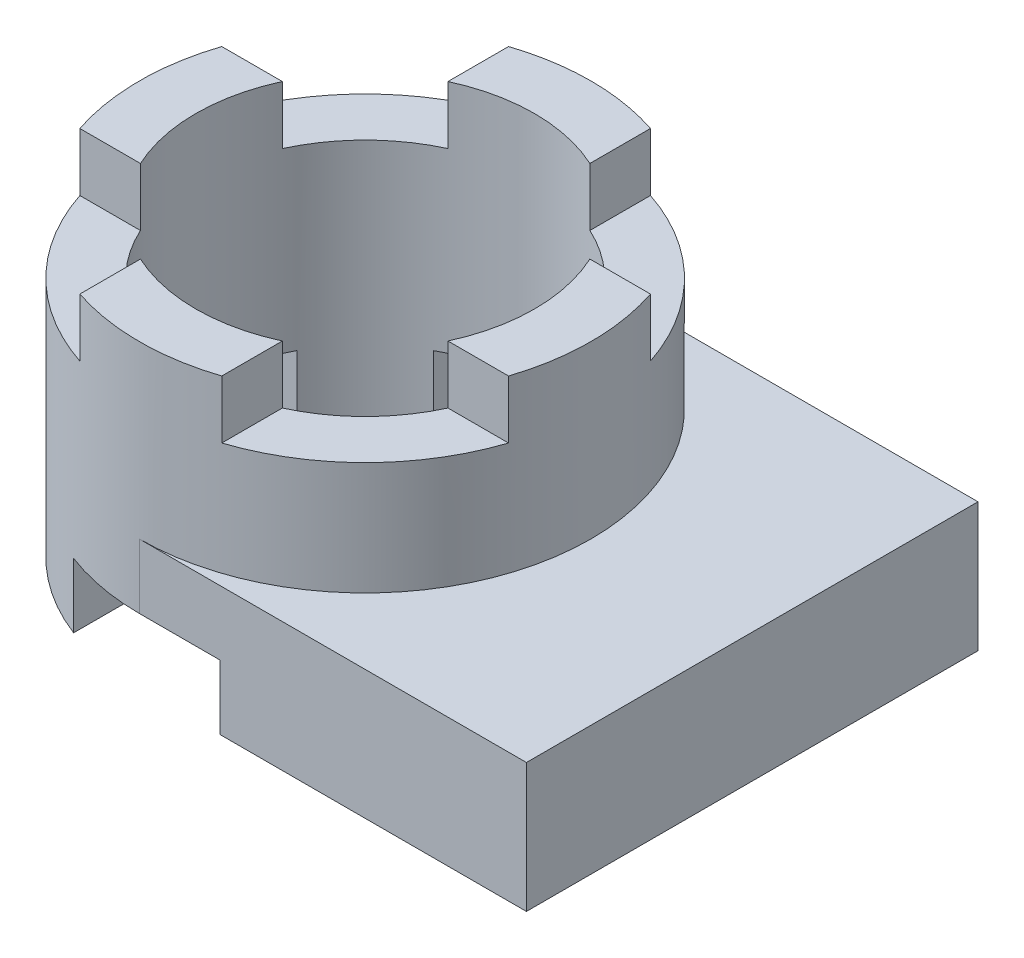
from build123d import *
from build123d.topology import SkipClean

# Parameters (mm, degrees)
SKETCH_1_R          = 7
SKETCH_1_R_2        = 5.25
EXTRUDE_3_DEPTH     = 4
SKETCH_2_R          = 7
SKETCH_2_R_2        = 5.25
EXTRUDE_4_DEPTH     = 3.5
CUT_EXTRUDE_1_DEPTH = 2
EXTRUDE_5_DEPTH     = 1.8


with BuildPart() as part:
    # 草图1 → 凸台-拉伸3 (new body)
    # profile 1 of 2: a face of its own
    with BuildSketch(Plane(origin=(0, 0, 0), x_dir=(1, 0, 0), z_dir=(0, 1, 0))):
        with BuildLine():
            Line((12, 7), (0, 7))
            ThreePointArc((0, 7), (4.949747468, 4.949747468), (7, 0))
            ThreePointArc((7, 0), (4.949747468, -4.949747468), (0, -7))
            Line((0, -7), (12, -7))
            Line((12, -7), (12, 7))
        make_face()
    # profile 2 of 2: a face of its own
    with BuildSketch(Plane(origin=(0, 0, 0), x_dir=(1, 0, 0), z_dir=(0, 1, 0))):
        Circle(SKETCH_1_R)
        with Locations(Location((0, 0, 0), (0, 0, 270))):
            Circle(SKETCH_1_R_2, mode=Mode.SUBTRACT)
    extrude(amount=EXTRUDE_3_DEPTH)

    # 草图2 → 凸台-拉伸4 (add)
    with BuildSketch(Plane(origin=(0, 4, 0), x_dir=(1, 0, 0), z_dir=(0, 1, 0))):
        with Locations(Location((0, 0, 0), (0, 0, 270))):
            Circle(SKETCH_2_R)
        with Locations(Location((0, 0, 0), (0, 0, 270))):
            Circle(SKETCH_2_R_2, mode=Mode.SUBTRACT)
    extrude(amount=EXTRUDE_4_DEPTH)

    # 草图3 → 切除-拉伸1 (cut)
    with BuildSketch(Plane.XZ):
        Polygon((-2.5, -8.5), (2.5, -8.5), (2.5, -2.5), (6, -2.5), (6, 2.5), (2.5, 2.5), (2.5, 8.5), (-2.5, 8.5), (-2.5, 2.5), (-6, 2.5), (-6, -2.5), (-2.5, -2.5), align=None)
    extrude(amount=-CUT_EXTRUDE_1_DEPTH, mode=Mode.SUBTRACT)

    # 草图4 → 凸台-拉伸5 (add)
    with SkipClean():  # the faces are left unmerged after this step: merging them gives an invalid solid
        with BuildSketch(Plane(origin=(0, 7.5, 0), x_dir=(1, 0, 0), z_dir=(0, 1, 0))):
            with BuildLine():
                ThreePointArc((-4.766812352, -2.2), (-5.25, 0), (-4.766812352, 2.2))
                Line((-4.766812352, 2.2), (-6.64529909, 2.2))
                ThreePointArc((-6.64529909, 2.2), (-7, 0), (-6.64529909, -2.2))
                Line((-6.64529909, -2.2), (-4.766812352, -2.2))
            make_face()
            with BuildLine():
                ThreePointArc((-2.2, 4.766812352), (0, 5.25), (2.2, 4.766812352))
                Line((2.2, 4.766812352), (2.2, 6.64529909))
                ThreePointArc((2.2, 6.64529909), (0, 7), (-2.2, 6.64529909))
                Line((-2.2, 6.64529909), (-2.2, 4.766812352))
            make_face()
            with BuildLine():
                Line((6.64529909, 2.2), (4.766812352, 2.2))
                ThreePointArc((4.766812352, 2.2), (5.127780458, 1.126218263), (5.25, 0))
                ThreePointArc((5.25, 0), (5.127780458, -1.126218263), (4.766812352, -2.2))
                Line((4.766812352, -2.2), (6.64529909, -2.2))
                ThreePointArc((6.64529909, -2.2), (6.910755879, -1.11420518), (7, 0))
                ThreePointArc((7, 0), (6.910755879, 1.11420518), (6.64529909, 2.2))
            make_face()
            with BuildLine():
                Line((2.2, -6.64529909), (2.2, -4.766812352))
                ThreePointArc((2.2, -4.766812352), (0, -5.25), (-2.2, -4.766812352))
                Line((-2.2, -4.766812352), (-2.2, -6.64529909))
                ThreePointArc((-2.2, -6.64529909), (0, -7), (2.2, -6.64529909))
            make_face()
        extrude(amount=EXTRUDE_5_DEPTH)


solid = part.part
